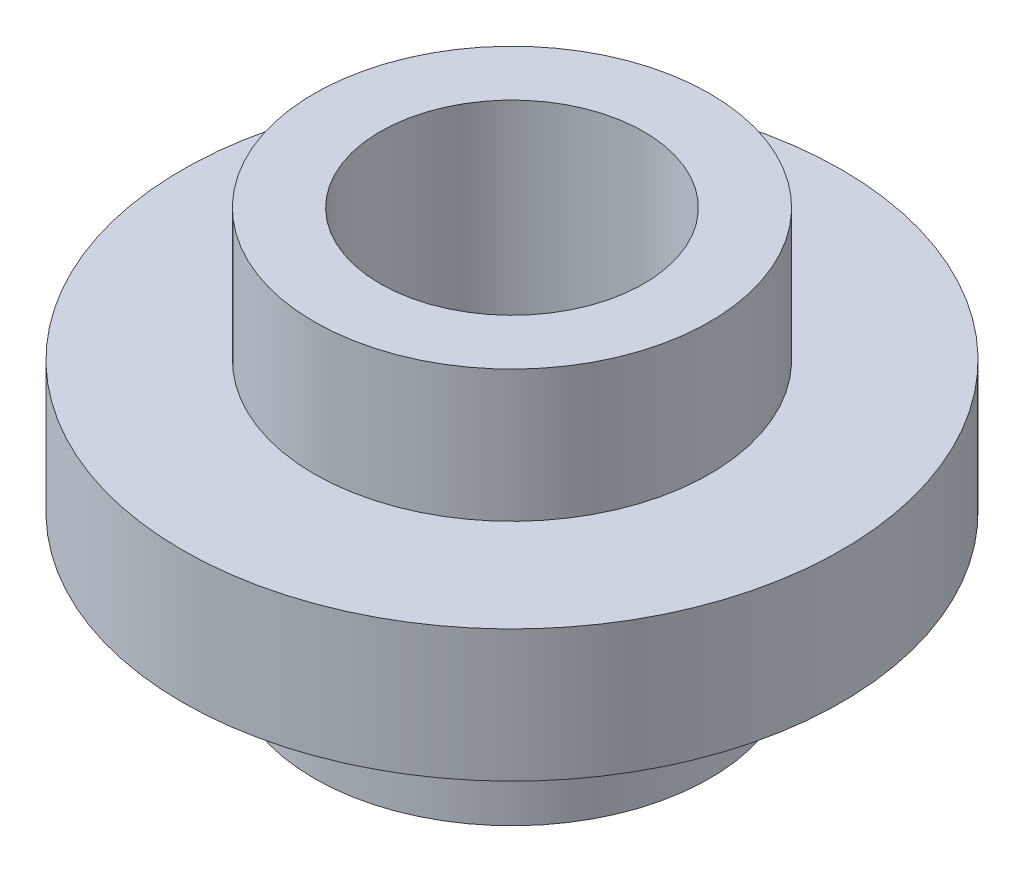
from build123d import *

# Parameters (mm, degrees)
SKETCH1_R                = 7.9375
SKETCH1_R_2              = 3.175
BOSS_EXTRUDE1_DEPTH      = 3.175
BOSS_EXTRUDE2_DEPTH      = 3.175
BOSS_EXTRUDE2_DEPTH_BACK = 6.35
SKETCH2_R                = 4.7625
SKETCH2_R_2              = 3.175


with BuildPart() as part:
    # Sketch1 → Boss-Extrude1 (new body)
    with BuildSketch(Plane(origin=(0, 0, 0), x_dir=(1, 0, 0), z_dir=(0, 1, 0))):
        with Locations(Location((0, 0, 0), (0, 0, 270))):
            Circle(SKETCH1_R)
        with Locations(Location((0, 0, 0), (0, 0, 270))):
            Circle(SKETCH1_R_2, mode=Mode.SUBTRACT)
    extrude(amount=BOSS_EXTRUDE1_DEPTH)

    # Sketch2 → Boss-Extrude2 (add, two sides: drawn at the far end of the back side and taken through both)
    with BuildSketch(Plane(origin=(0, 3.175, 0), x_dir=(1, 0, 0), z_dir=(0, 1, 0)).offset(-BOSS_EXTRUDE2_DEPTH_BACK)):
        with Locations(Location((0, 0, 0), (0, 0, 270))):
            Circle(SKETCH2_R)
        with Locations(Location((0, 0, 0), (0, 0, 270))):
            Circle(SKETCH2_R_2, mode=Mode.SUBTRACT)
    extrude(amount=BOSS_EXTRUDE2_DEPTH + BOSS_EXTRUDE2_DEPTH_BACK)


solid = part.part
